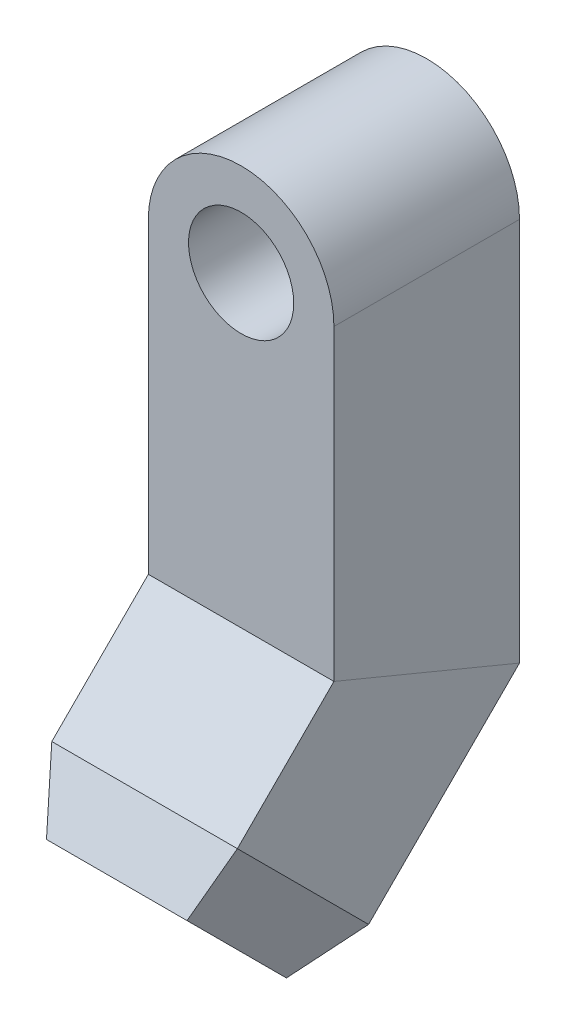
from build123d import *

# Parameters (mm, degrees)
SKETCH11_W          = 38.1
SKETCH11_H          = 38.1
SKETCH12_W          = 38.1
SKETCH12_H          = 38.1
BOSS_EXTRUDE5_DEPTH = 12.7
BOSS_EXTRUDE5_TAPER = 20
BOSS_EXTRUDE6_DEPTH = 38.1
SKETCH14_R          = 10.795
CUT_EXTRUDE2_DEPTH  = 38.1
SKETCH15_R          = 10.795
CUT_EXTRUDE3_DEPTH  = 12.7


with BuildPart() as part:
    # Sweep1: sweep along a path in Sketch10
    with BuildLine(Plane(origin=(0, 0, 0), x_dir=(0, 0, -1), z_dir=(1, 0, 0))) as sweep1_path:
        Line((0, 96.393), (0, 25.4))
        Line((0, 25.4), (-25.4, 0))
    # Sketch11 → Sweep1 (sweep)
    with BuildSketch(Plane(origin=(0, 96.393, 0), x_dir=(1, 0, 0), z_dir=(0, 1, 0))):
        Rectangle(SKETCH11_W, SKETCH11_H)
    sweep(path=sweep1_path.line, transition=Transition.RIGHT)

    # Sketch12 → Boss-Extrude5 (add)
    with BuildSketch(Plane(origin=(0, -12.7, 12.7), x_dir=(1, 0, 0), z_dir=(0, -0.7071067811865461, 0.7071067811865489))):
        with Locations((0, 17.960512242)):
            Rectangle(SKETCH12_W, SKETCH12_H)
    extrude(amount=BOSS_EXTRUDE5_DEPTH, taper=BOSS_EXTRUDE5_TAPER)

    # Sketch13 → Boss-Extrude6 (add)
    with BuildSketch(Plane(origin=(0, 0, -19.05), x_dir=(-1, 0, 0), z_dir=(0, 0, -1))):
        with BuildLine():
            Line((-19.05, 96.393), (19.05, 96.393))
            ThreePointArc((19.05, 96.393), (0, 115.443), (-19.05, 96.393))
        make_face()
    extrude(amount=-BOSS_EXTRUDE6_DEPTH)

    # Sketch14 → Cut-Extrude2 (cut)
    with BuildSketch(Plane.XY.offset(19.05)):
        with Locations((0, 96.393)):
            Circle(SKETCH14_R)
    extrude(amount=-CUT_EXTRUDE2_DEPTH, mode=Mode.SUBTRACT)

    # Sketch15 → Cut-Extrude3 (cut)
    with BuildSketch(Plane(origin=(0, -21.680256121, 21.680256121), x_dir=(1, 0, 0), z_dir=(0, -0.7071067811865461, 0.7071067811865489))):
        with Locations(Location((0, 17.960512242, 0), (0, 0, 270))):
            Circle(SKETCH15_R)
    extrude(amount=-CUT_EXTRUDE3_DEPTH, mode=Mode.SUBTRACT)


solid = part.part
